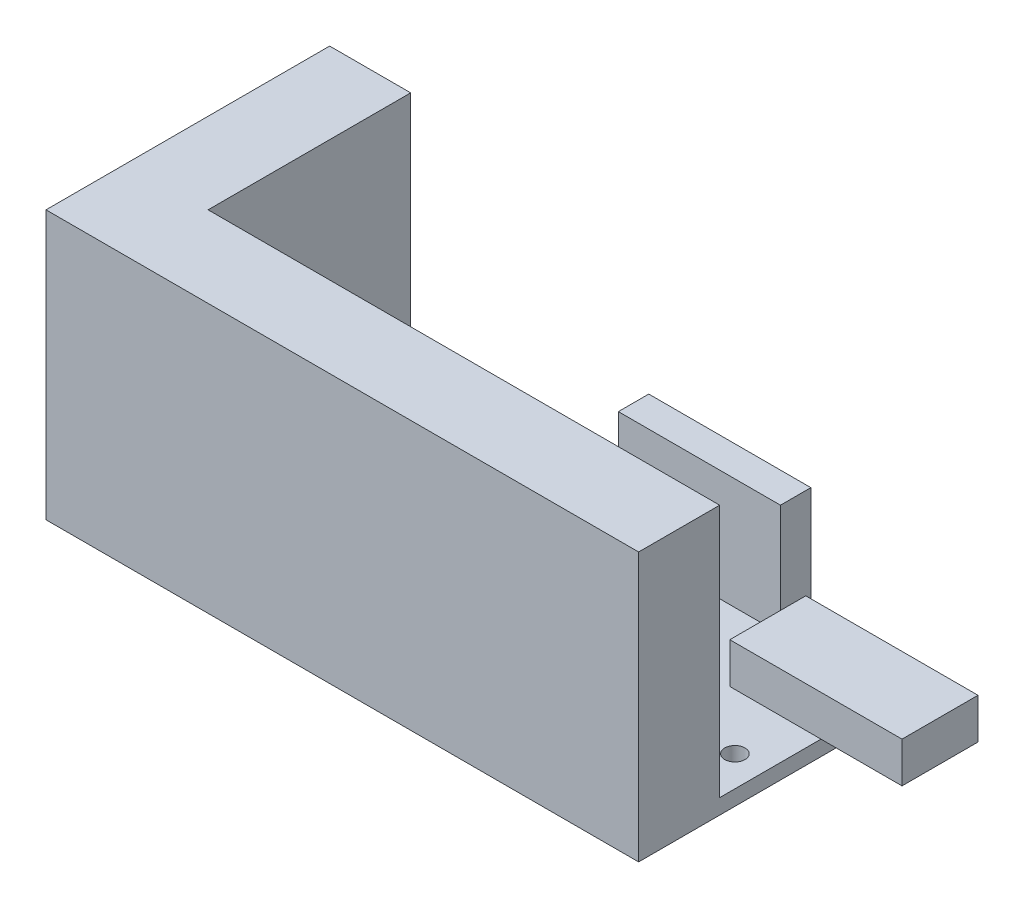
from build123d import *

# Parameters (mm, degrees)
SKETCH_1_W          = 58.5
SKETCH_1_H          = 28
EXTRUDE_1_DEPTH     = 1.5
SKETCH_2_R          = 1
CUT_EXTRUDE_1_DEPTH = 1.5
EXTRUDE_2_DEPTH     = 25
SKETCH_4_W          = 16
SKETCH_4_H          = 3
EXTRUDE_3_DEPTH     = 11
SKETCH_5_W          = 8
SKETCH_5_H          = 7.5
SKETCH_5_W_2        = 9
EXTRUDE_4_DEPTH     = 4


with BuildPart() as part:
    # Эскиз1 → Бобышка-Вытянуть1 (new body)
    with BuildSketch(Plane(origin=(0, 0, 0), x_dir=(1, 0, 0), z_dir=(0, 1, 0))):
        with Locations((-29.25, 14)):
            Rectangle(SKETCH_1_W, SKETCH_1_H)
    extrude(amount=EXTRUDE_1_DEPTH)

    # Эскиз2 → Вырез-Вытянуть1 (cut)
    with BuildSketch(Plane(origin=(0, 1.5, 0), x_dir=(1, 0, 0), z_dir=(0, 1, 0))):
        with Locations(Location((-3, 12.5, 0), (0, 0, 270))):
            Circle(SKETCH_2_R)
        with Locations(Location((-41.5, 25.5, 0), (0, 0, 270))):
            Circle(SKETCH_2_R)
    extrude(amount=-CUT_EXTRUDE_1_DEPTH, mode=Mode.SUBTRACT)

    # Эскиз3 → Бобышка-Вытянуть2 (add)
    with BuildSketch(Plane(origin=(0, 1.5, 0), x_dir=(1, 0, 0), z_dir=(0, 1, 0))):
        Polygon((0, 0), (0, 8), (-50.5, 8), (-50.5, 28), (-58.5, 28), (-58.5, 0), align=None)
    extrude(amount=EXTRUDE_2_DEPTH)

    # Эскиз4 → Бобышка-Вытянуть3 (add)
    with BuildSketch(Plane(origin=(0, 1.5, 0), x_dir=(1, 0, 0), z_dir=(0, 1, 0))):
        with Locations((-19, 26.5)):
            Rectangle(SKETCH_4_W, SKETCH_4_H)
    extrude(amount=EXTRUDE_3_DEPTH)

    # Эскиз5 → Бобышка-Вытянуть4 (add)
    with BuildSketch(Plane(origin=(0, 1.5, 0), x_dir=(1, 0, 0), z_dir=(0, 1, 0))):
        with Locations((4, 21.75)):
            Rectangle(SKETCH_5_W, SKETCH_5_H)
        with Locations((-4.5, 21.75)):
            Rectangle(SKETCH_5_W_2, SKETCH_5_H)
    extrude(amount=EXTRUDE_4_DEPTH)


solid = part.part
